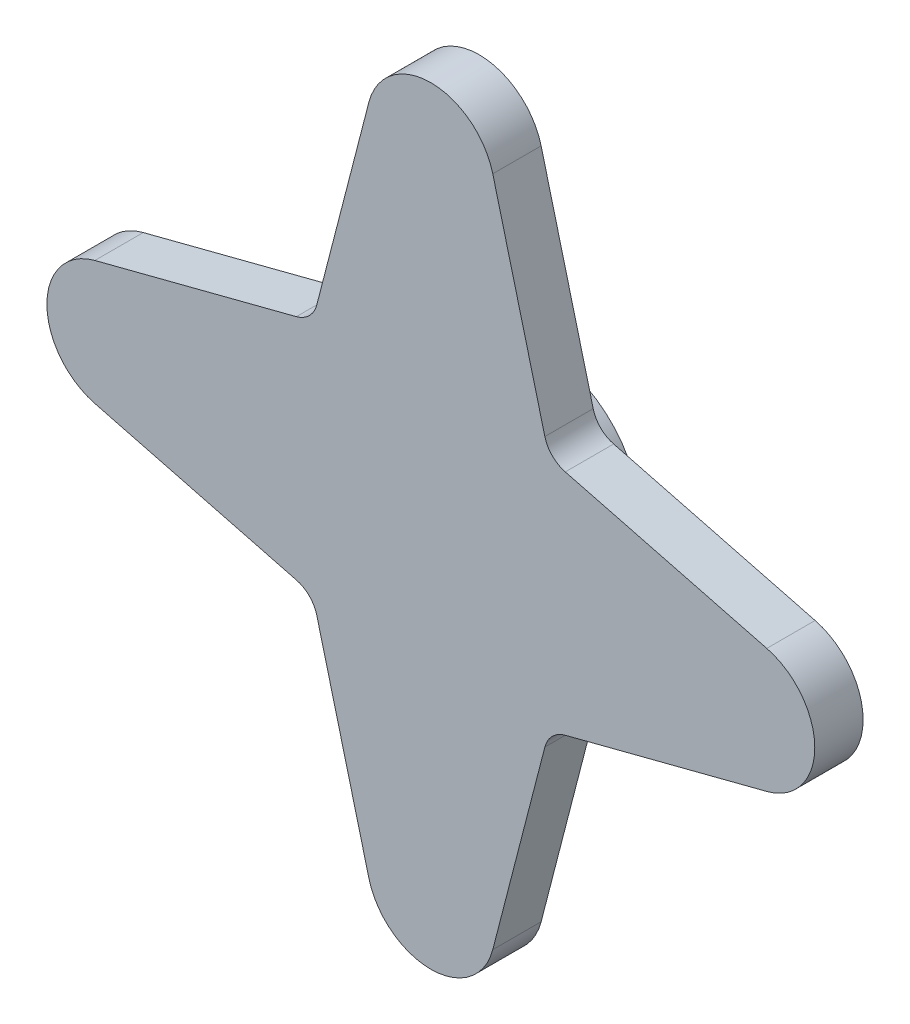
from build123d import *

# Parameters (mm, degrees)
SKETCH1_R              = 3.45
SKETCH1_R_2            = 2.5
BOSS_EXTRUDE1_DEPTH    = 2.2
BOSS_EXTRUDE4_START    = 1.7
SKETCH1_9_R            = 3.45
SKETCH1_9_R_2          = 2.5
BOSS_EXTRUDE4_DEPTH    = 1.7
BOSS_EXTRUDE5_START    = 1.7
BOSS_EXTRUDE5_DEPTH    = 1.7
MIRROR3_START          = 1.7
MIRROR3_COPY_1_DEPTH   = 1.7
FILLET1_R              = 1
SKETCH2_R              = 2.5
F_0ZVARIANCEBOSS_DEPTH = 0.2


with BuildPart() as part:
    # Sketch1 → Boss-Extrude1 (new body)
    with BuildSketch(Plane.XY):
        with Locations((-5.15, 0)):
            Circle(SKETCH1_R)
        with Locations((-5.15, 0)):
            Circle(SKETCH1_R_2, mode=Mode.SUBTRACT)
    extrude(amount=-BOSS_EXTRUDE1_DEPTH)

    # Sketch1<9> → Boss-Extrude4 (add)
    # profile 1 of 2: a face of its own
    with BuildSketch(Plane.XY.offset(BOSS_EXTRUDE4_START)):
        with Locations((-5.15, 0)):
            Circle(SKETCH1_9_R)
        with Locations((-5.15, 0)):
            Circle(SKETCH1_9_R_2, mode=Mode.SUBTRACT)
    # profile 2 of 2: a face of its own
    with BuildSketch(Plane.XY.offset(BOSS_EXTRUDE4_START)):
        with Locations((-5.15, 0)):
            Circle(SKETCH1_9_R_2)
    extrude(amount=-BOSS_EXTRUDE4_DEPTH)

    # Sketch1<10> → Boss-Extrude5 (add)
    with BuildSketch(Plane.XY.offset(BOSS_EXTRUDE5_START)):
        with BuildLine():
            Line((-7.589518395, 2.439518395), (-8.6, 3.45))
            Line((-8.6, 3.45), (-9.307106781, 4.157106781))
            Line((-9.307106781, 4.157106781), (-16.963017409, 2.178419472))
            ThreePointArc((-16.963017409, 2.178419472), (-18.65, 0), (-16.963017409, -2.178419472))
            Line((-16.963017409, -2.178419472), (-9.307106781, -4.157106781))
            Line((-9.307106781, -4.157106781), (-8.6, -3.45))
            Line((-8.6, -3.45), (-7.589518395, -2.439518395))
            ThreePointArc((-7.589518395, -2.439518395), (-8.6, 0), (-7.589518395, 2.439518395))
        make_face()
    boss_extrude5 = extrude(amount=-BOSS_EXTRUDE5_DEPTH)

    # Mirror2: Boss-Extrude5 across plane
    add(boss_extrude5.mirror(Plane(origin=(-2.575, 2.575, 0), x_dir=(0, 0, 1), z_dir=(0.7071067811865476, -0.7071067811865475, 0))))

    # Mirror3: Boss-Extrude5 across plane
    add(boss_extrude5.mirror(Plane(origin=(-2.575, -2.575, 0), x_dir=(0, 0, 1), z_dir=(0.7071067811865476, 0.7071067811865475, 0))))

    # Mirror3 copy 1 sketch → Mirror3 copy 1 (add)
    with BuildSketch(Plane(origin=(-10.3, 0, 0), x_dir=(-1, 0, 0), z_dir=(0, 0, 1)).offset(MIRROR3_START)):
        with BuildLine():
            Line((-7.589518395, 2.439518395), (-8.6, 3.45))
            Line((-8.6, 3.45), (-9.307106781, 4.157106781))
            Line((-9.307106781, 4.157106781), (-16.963017409, 2.178419472))
            ThreePointArc((-16.963017409, 2.178419472), (-18.65, 0), (-16.963017409, -2.178419472))
            Line((-16.963017409, -2.178419472), (-9.307106781, -4.157106781))
            Line((-9.307106781, -4.157106781), (-8.6, -3.45))
            Line((-8.6, -3.45), (-7.589518395, -2.439518395))
            ThreePointArc((-7.589518395, -2.439518395), (-8.6, 0), (-7.589518395, 2.439518395))
        make_face()
    extrude(amount=-MIRROR3_COPY_1_DEPTH)

    # Fillet1
    fillet1_edges = [part.edges().sort_by_distance(p)[0] for p in [
        (-9.307106781, 4.157106781, 0.85),
        (-9.307106781, -4.157106781, 0.85),
        (-0.992893219, -4.157106781, 0.85),
        (-0.992893219, 4.157106781, 0.85),
    ]]
    fillet(fillet1_edges, radius=FILLET1_R)

    # Sketch2 → 0ZvarianceBoss (add)
    with BuildSketch(Plane(origin=(0, 0, 0), x_dir=(-1, 0, 0), z_dir=(0, 0, -1))):
        with Locations(Location((5.15, 0, 0), (0, 0, 180))):
            Circle(SKETCH2_R)
    extrude(amount=F_0ZVARIANCEBOSS_DEPTH)


solid = part.part
